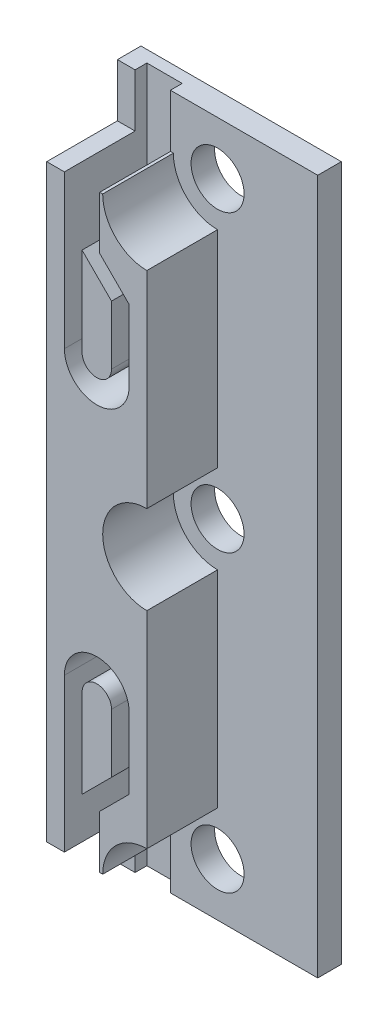
from build123d import *

# Parameters (mm, degrees)
ESQUISSE1_W             = 17
ESQUISSE1_H             = 59
BOSS_EXTRU_1_DEPTH      = 2
ESQUISSE2_W             = 8.5
ESQUISSE2_H             = 50
BOSS_EXTRU_2_DEPTH      = 6
ESQUISSE4_R             = 2.25
ENL_V_MAT_EXTRU_6_DEPTH = 27
ESQUISSE3_W             = 1.5
ESQUISSE3_H             = 7
ENL_V_MAT_EXTRU_7_DEPTH = 7
ESQUISSE5_R             = 3.75
ENL_V_MAT_EXTRU_8_DEPTH = 6


with BuildPart() as part:
    # Esquisse1 → Boss.-Extru.1 (new body)
    with BuildSketch(Plane.XY):
        with Locations((8.5, -29.5)):
            Rectangle(ESQUISSE1_W, ESQUISSE1_H)
    extrude(amount=BOSS_EXTRU_1_DEPTH)

    # Esquisse2 → Boss.-Extru.2 (add)
    with BuildSketch(Plane.XY.offset(2)):
        with Locations((4.25, -29.5)):
            Rectangle(ESQUISSE2_W, ESQUISSE2_H)
    extrude(amount=BOSS_EXTRU_2_DEPTH)

    # Esquisse4 → Enlèv. mat.-Extru.6 (cut)
    with BuildSketch(Plane.XY.offset(8)):
        with Locations((8.5, -54.5)):
            Circle(ESQUISSE4_R)
        with Locations((8.5, -29.5)):
            Circle(ESQUISSE4_R)
        with Locations((8.5, -4.5)):
            Circle(ESQUISSE4_R)
    extrude(amount=-ENL_V_MAT_EXTRU_6_DEPTH, mode=Mode.SUBTRACT)

    # Esquisse3 → Enlèv. mat.-Extru.7 (cut)
    with BuildSketch(Plane.XY.offset(8)):
        with Locations((2.25, -58)):
            Rectangle(ESQUISSE3_W, ESQUISSE3_H)
        with Locations((3.75, -58)):
            Rectangle(ESQUISSE3_W, ESQUISSE3_H)
        Polygon((4.5, -48), (3, -49.5), (3, -54.5), (4.5, -54.5), (4.5, -50), align=None)
        Polygon((3, -49.5), (3, -42), (3, -41.5), (1.5, -41.5), (1.5, -54.5), (3, -54.5), align=None)
        Polygon((5.5, -41.5), (5.5, -42), (5.5, -47), (4.5, -48), (4.5, -50), (7, -47.5), (7, -41.5), align=None)
        with BuildLine():
            Line((4.25, -38.75), (4.25, -40.75))
            ThreePointArc((4.25, -40.75), (4.934653197, -40.954174967), (5.395643924, -41.5))
            Line((5.395643924, -41.5), (5.5, -41.5))
            Line((5.5, -41.5), (7, -41.5))
            ThreePointArc((7, -41.5), (6.194543648, -39.555456352), (4.25, -38.75))
        make_face()
        with BuildLine():
            Line((1.5, -41.5), (3, -41.5))
            Line((3, -41.5), (3.104356076, -41.5))
            ThreePointArc((3.104356076, -41.5), (3.565346803, -40.954174967), (4.25, -40.75))
            Line((4.25, -40.75), (4.25, -38.75))
            ThreePointArc((4.25, -38.75), (2.305456352, -39.555456352), (1.5, -41.5))
        make_face()
        with BuildLine():
            Line((3, -41.5), (3, -42))
            ThreePointArc((3, -42), (3.026367109, -41.744612945), (3.104356076, -41.5))
            Line((3.104356076, -41.5), (3, -41.5))
        make_face()
        with BuildLine():
            ThreePointArc((5.395643924, -41.5), (5.473632891, -41.744612945), (5.5, -42))
            Line((5.5, -42), (5.5, -41.5))
            Line((5.5, -41.5), (5.395643924, -41.5))
        make_face()
    enl_v_mat_extru_7 = extrude(amount=-ENL_V_MAT_EXTRU_7_DEPTH, mode=Mode.SUBTRACT)

    # Symétrie1: Enlèv. mat.-Extru.7 across plane
    add(enl_v_mat_extru_7.mirror(Plane.ZX.offset(-29.5)), mode=Mode.SUBTRACT)

    # Esquisse5 → Enlèv. mat.-Extru.8 (cut)
    with BuildSketch(Plane.XY.offset(8)):
        with Locations((8.5, -29.5)):
            Circle(ESQUISSE5_R)
        with Locations((8.5, -4.5)):
            Circle(ESQUISSE5_R)
        with Locations((8.5, -54.5)):
            Circle(ESQUISSE5_R)
    extrude(amount=-ENL_V_MAT_EXTRU_8_DEPTH, mode=Mode.SUBTRACT)


solid = part.part
